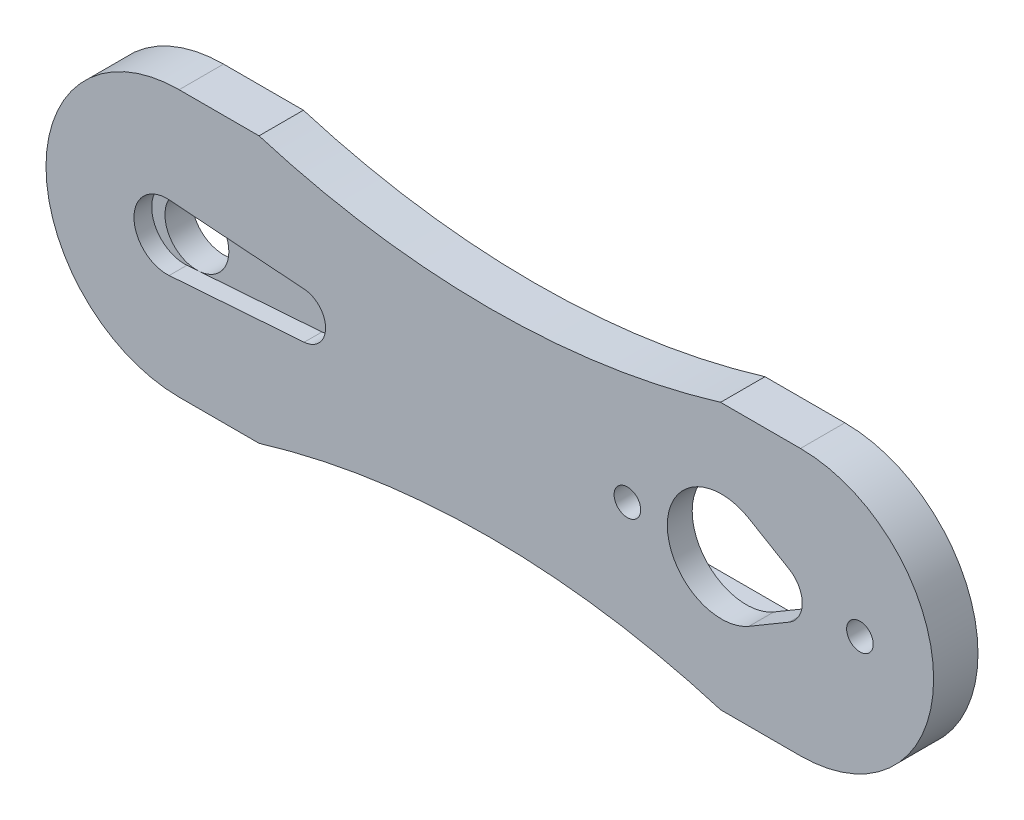
from build123d import *

# Parameters (mm, degrees)
SKETCH1_R             = 3.6
BOSS_EXTRUDE1_DEPTH   = 5
CORTAR_EXTRUIR1_START = -2
CORTAR_EXTRUIR1_DEPTH = 2
CROQUIS3_W            = 33
CROQUIS3_H            = 13
CORTAR_EXTRUIR2_DEPTH = 2.2
CORTAR_EXTRUIR3_DEPTH = 3
CROQUIS6_R            = 1.5
CORTAR_EXTRUIR4_DEPTH = 3


with BuildPart() as part:
    # Sketch1 → Boss-Extrude1 (new body)
    with BuildSketch(Plane(origin=(0, 0, 0), x_dir=(-1, 0, 0), z_dir=(0, 0, -1))):
        with BuildLine():
            Line((-70, 0), (-61, 0))
            ThreePointArc((-61, 0), (-35, -3.837363086), (-9, 0))
            Line((-9, 0), (0, 0))
            ThreePointArc((0, 0), (15, -15), (0, -30))
            Line((0, -30), (-9, -30))
            ThreePointArc((-9, -30), (-35, -26.162636914), (-61, -30))
            Line((-61, -30), (-70, -30))
            ThreePointArc((-70, -30), (-85, -15), (-70, 0))
        make_face()
        with Locations(Location((0, -15, 0), (0, 0, 180))):
            Circle(SKETCH1_R, mode=Mode.SUBTRACT)
    extrude(amount=-BOSS_EXTRUDE1_DEPTH)

    # Croquis1 → Cortar-Extruir1 (cut)
    with BuildSketch(Plane.XY.offset(5).offset(CORTAR_EXTRUIR1_START)):
        with BuildLine():
            Line((14.08705036, -12.406737159), (0.258992817, -11.409328375))
            ThreePointArc((0.258992817, -11.409328375), (2.635562003, -12.547692326), (3.6, -15))
            ThreePointArc((3.6, -15), (2.635561992, -17.452307685), (0.258992787, -18.590671627))
            Line((0.258992787, -18.590671627), (14.08705036, -17.593262841))
            ThreePointArc((14.08705036, -17.593262841), (16.5, -15), (14.08705036, -12.406737159))
        make_face()
        with BuildLine():
            Line((0.258992817, -11.409328375), (-1.12381295, -11.309587495))
            ThreePointArc((-1.12381295, -11.309587495), (-5.09, -15), (-1.12381295, -18.690412505))
            Line((-1.12381295, -18.690412505), (0.258992787, -18.590671627))
            ThreePointArc((0.258992787, -18.590671627), (-3.6, -14.999999985), (0.258992817, -11.409328375))
        make_face()
    extrude(amount=CORTAR_EXTRUIR1_DEPTH, mode=Mode.SUBTRACT)

    # Croquis3 → Cortar-Extruir2 (cut)
    with BuildSketch(Plane(origin=(0, 0, 0), x_dir=(-1, 0, 0), z_dir=(0, 0, -1))):
        with Locations((-63.5, -15)):
            Rectangle(CROQUIS3_W, CROQUIS3_H)
    extrude(amount=-CORTAR_EXTRUIR2_DEPTH, mode=Mode.SUBTRACT)

    # Croquis4 → Cortar-Extruir3 (cut)
    with BuildSketch(Plane(origin=(0, 0, 2.2), x_dir=(-1, 0, 0), z_dir=(0, 0, -1))):
        with BuildLine():
            Line((-64.2, -9.746429785), (-68.724590164, -12.416276944))
            ThreePointArc((-68.724590164, -12.416276944), (-70.2, -15), (-68.724590164, -17.583723056))
            Line((-68.724590164, -17.583723056), (-64.2, -20.253570215))
            ThreePointArc((-64.2, -20.253570215), (-55, -15), (-64.2, -9.746429785))
        make_face()
    extrude(amount=-CORTAR_EXTRUIR3_DEPTH, mode=Mode.SUBTRACT)

    # Croquis6 → Cortar-Extruir4 (cut)
    with BuildSketch(Plane(origin=(0, 0, 2.2), x_dir=(-1, 0, 0), z_dir=(0, 0, -1))):
        with Locations((-50.5, -15)):
            Circle(CROQUIS6_R)
        with Locations((-76.7, -15)):
            Circle(CROQUIS6_R)
    extrude(amount=-CORTAR_EXTRUIR4_DEPTH, mode=Mode.SUBTRACT)


solid = part.part
